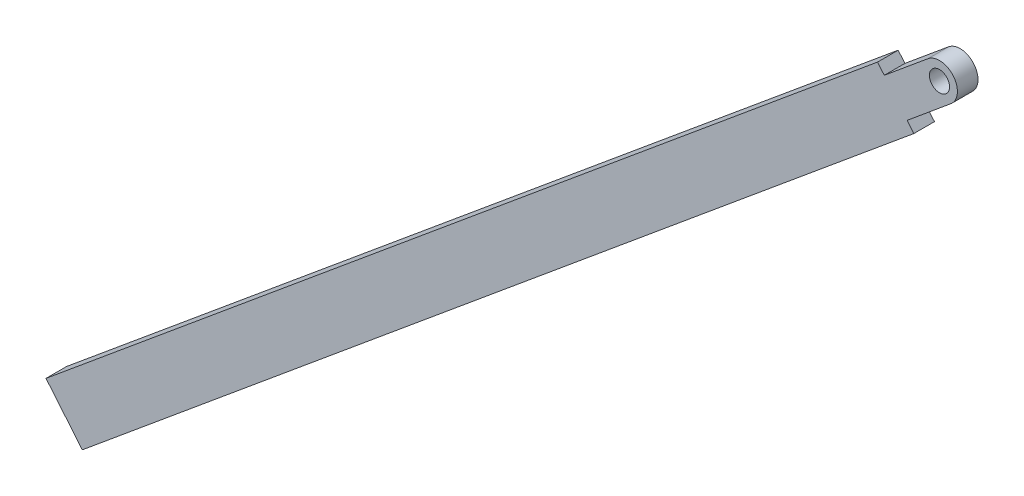
from build123d import *

# Parameters (mm, degrees)
BOSS_EXTRUDE1_DEPTH = 4.6
SKETCH2_R           = 2.25
CUT_EXTRUDE1_DEPTH  = 362.31293858


with BuildPart() as part:
    # Sketch1 → Boss-Extrude1 (new body)
    with BuildSketch(Plane.XY):
        with BuildLine():
            Line((6.553588095, 296.721171027), (-3.221693894, 288.613528827))
            Line((-3.221693894, 288.613528827), (-1.721460888, 286.804716805))
            Line((-1.721460888, 286.804716805), (-187.42097357, 132.785097993))
            Line((-187.42097357, 132.785097993), (-195.528615771, 142.560379981))
            Line((-195.528615771, 142.560379981), (-9.829103088, 296.579998794))
            Line((-9.829103088, 296.579998794), (-8.328870083, 294.771186772))
            Line((-8.328870083, 294.771186772), (1.446411905, 302.878828973))
            ThreePointArc((1.446411905, 302.878828973), (7.078828973, 302.353588095), (6.553588095, 296.721171027))
        make_face()
    extrude(amount=BOSS_EXTRUDE1_DEPTH)

    # Sketch2 → Cut-Extrude1 (cut, through all)
    with BuildSketch(Plane.XY.offset(4.6)):
        with Locations((4, 299.8)):
            Circle(SKETCH2_R)
    extrude(amount=-CUT_EXTRUDE1_DEPTH, mode=Mode.SUBTRACT)


solid = part.part
